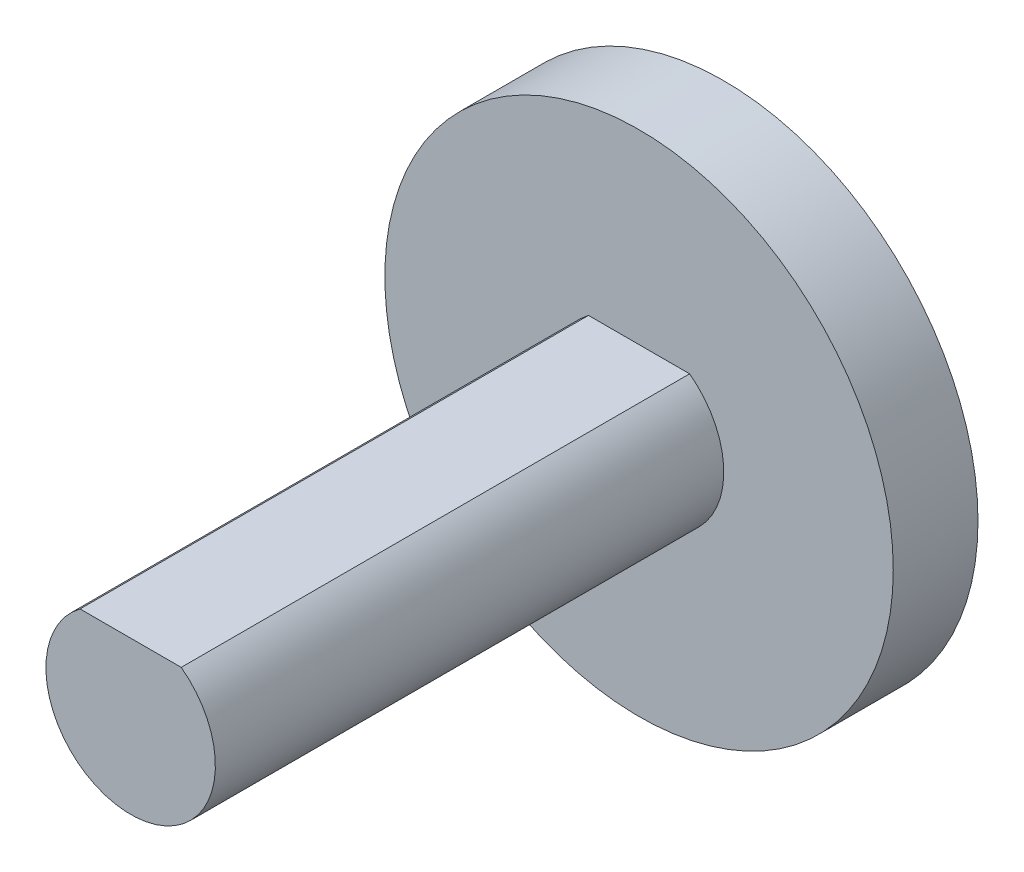
from build123d import *

# Parameters (mm, degrees)
SKETCH1_R           = 7.5
BOSS_EXTRUDE1_DEPTH = 2.5
BOSS_EXTRUDE3_DEPTH = 15


with BuildPart() as part:
    # Sketch1 → Boss-Extrude1 (new body)
    with BuildSketch(Plane(origin=(0, 0, 0), x_dir=(0, 1, 0), z_dir=(0, 0, 1))):
        with Locations(Location((0, 0, 0), (0, 0, 270))):
            Circle(SKETCH1_R)
    extrude(amount=BOSS_EXTRUDE1_DEPTH)

    # Sketch2 → Boss-Extrude3 (add)
    with BuildSketch(Plane.XY.offset(2.5)):
        with BuildLine():
            Line((-1.492250117, 2.005789019), (1.492250117, 2.005789019))
            ThreePointArc((1.492250117, 2.005789019), (0, -2.5), (-1.492250117, 2.005789019))
        make_face()
    extrude(amount=BOSS_EXTRUDE3_DEPTH)


solid = part.part
